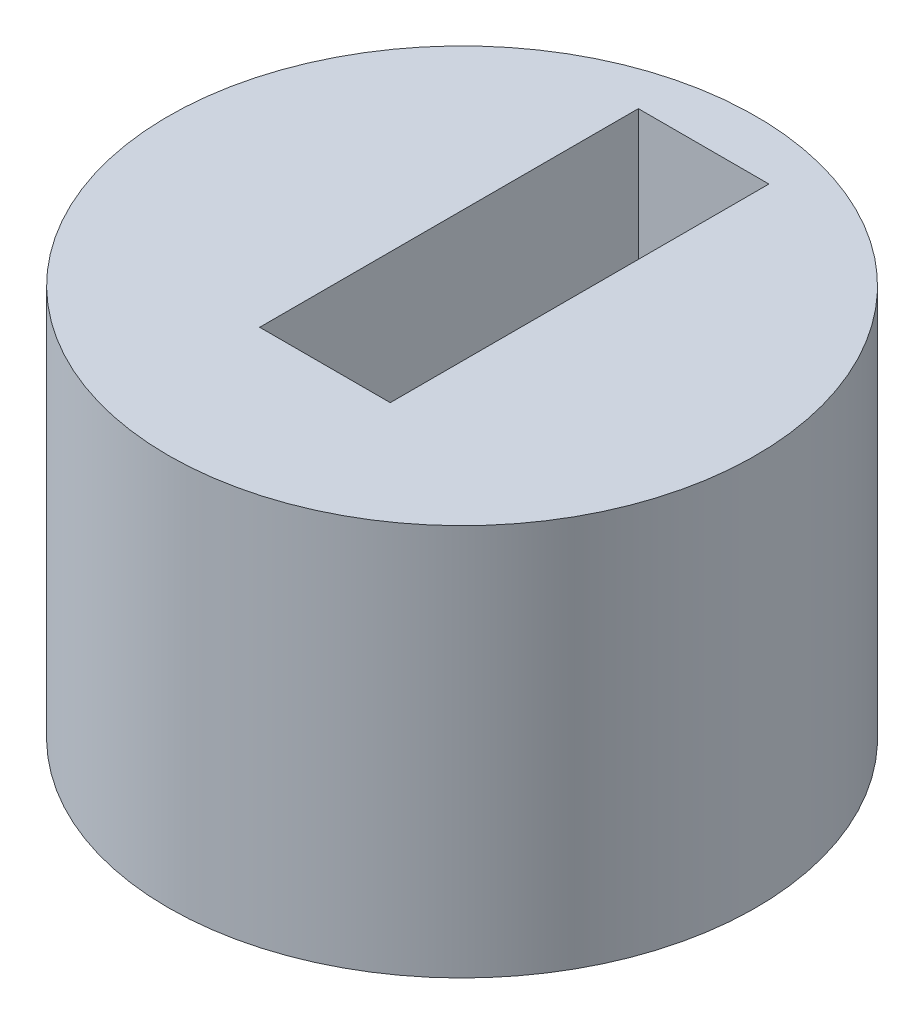
from build123d import *

# Parameters (mm, degrees)
SKETCH1_R           = 45
BOSS_EXTRUDE1_DEPTH = 60
SKETCH2_W           = 20
SKETCH2_H           = 58
CUT_EXTRUDE1_DEPTH  = 40


with BuildPart() as part:
    # Sketch1 → Boss-Extrude1 (new body)
    with BuildSketch(Plane(origin=(0, 0, 0), x_dir=(1, 0, 0), z_dir=(0, 1, 0))):
        with Locations(Location((0, 0, 0), (0, 0, 270))):
            Circle(SKETCH1_R)
    extrude(amount=BOSS_EXTRUDE1_DEPTH)

    # Sketch2 → Cut-Extrude1 (cut)
    with BuildSketch(Plane(origin=(0, 60, 0), x_dir=(1, 0, 0), z_dir=(0, 1, 0))):
        with Locations((0, 8)):
            Rectangle(SKETCH2_W, SKETCH2_H)
    extrude(amount=-CUT_EXTRUDE1_DEPTH, mode=Mode.SUBTRACT)


solid = part.part
